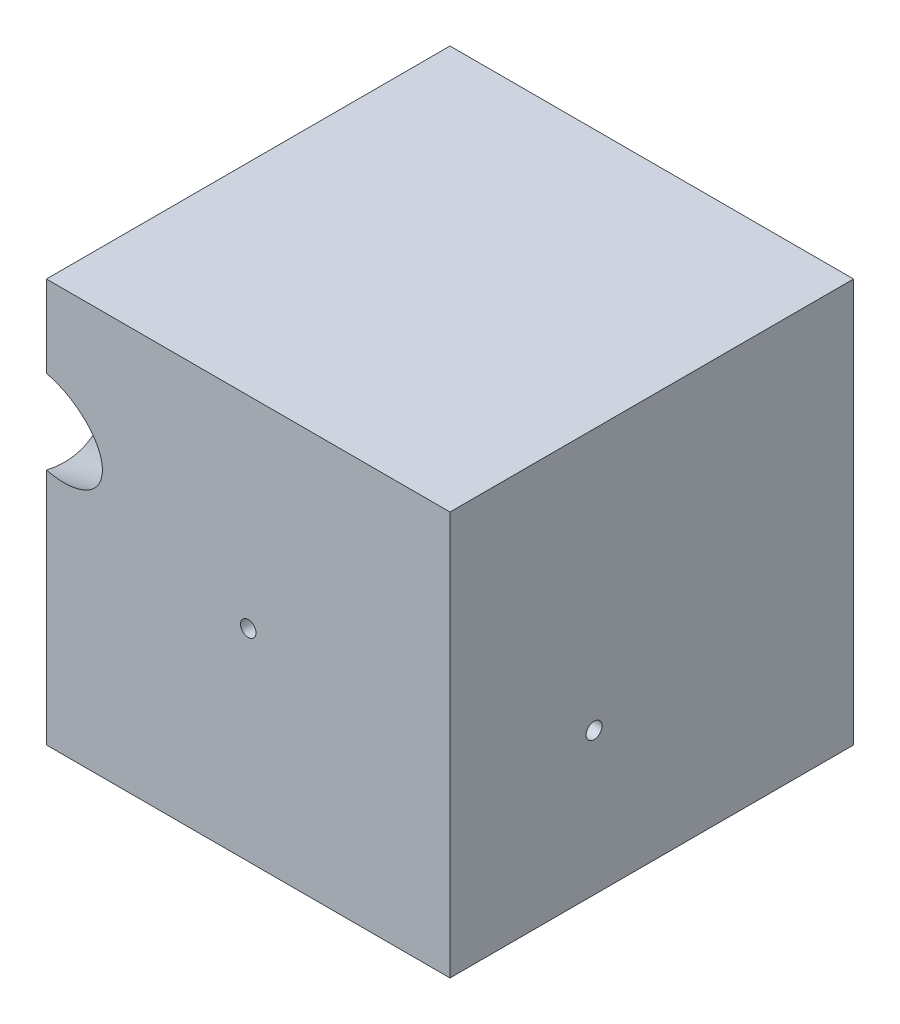
from build123d import *

# Parameters (mm, degrees)
SQUARE_W             = 52
SQUARE_H             = 52
CUBE_EXTRUSION_DEPTH = 52
STICK_CUT_START      = 15
STICK_HOLE_R         = 5.1
STICK_CUT_DEPTH      = 90.048032459
SKETCH12_R           = 1
CUT_EXTRUDE8_DEPTH   = 12
CUT_EXTRUDE9_START   = -12
SKETCH13_R           = 1
CUT_EXTRUDE9_DEPTH   = 12
SKETCH14_R           = 1
CUT_EXTRUDE10_DEPTH  = 12
SKETCH15_R           = 1.030667793
CUT_EXTRUDE11_DEPTH  = 12
SKETCH16_R           = 1
CUT_EXTRUDE12_DEPTH  = 12


with BuildPart() as part:
    # Square → Cube-Extrusion (new body)
    with BuildSketch(Plane.XY):
        Rectangle(SQUARE_W, SQUARE_H)
    extrude(amount=CUBE_EXTRUSION_DEPTH)

    # Stick-Hole → Stick-Cut (cut, through all)
    with BuildSketch(Plane(origin=(-28.888888889, 14.444444444, 28.888888889), x_dir=(-0.7453559924999299, -0.2981423969999719, -0.596284793999944), z_dir=(0.6666666666666667, -0.3333333333333332, -0.6666666666666667)).offset(STICK_CUT_START)):
        with Locations(Location((-14.635839315, -14.230249471, 0), (0, 0, 18.434948823))):
            Circle(STICK_HOLE_R)
    extrude(amount=-STICK_CUT_DEPTH, mode=Mode.SUBTRACT)

    # Sketch12 → Cut-Extrude8 (cut)
    with BuildSketch(Plane.XY.offset(52)):
        Circle(SKETCH12_R)
    extrude(amount=-CUT_EXTRUDE8_DEPTH, mode=Mode.SUBTRACT)

    # Sketch13 → Cut-Extrude9 (cut)
    with BuildSketch(Plane(origin=(0, 0, 0), x_dir=(-1, 0, 0), z_dir=(0, 0, -1)).offset(CUT_EXTRUDE9_START)):
        with Locations(Location((0, 0, 0), (0, 0, 180))):
            Circle(SKETCH13_R)
    extrude(amount=CUT_EXTRUDE9_DEPTH, mode=Mode.SUBTRACT)

    # Sketch14 → Cut-Extrude10 (cut)
    with BuildSketch(Plane.ZY.offset(26)):
        with Locations((10.514408983, 15.48249327)):
            Circle(SKETCH14_R)
        with Locations((20.449310987, -13.814590013)):
            Circle(SKETCH14_R)
    extrude(amount=-CUT_EXTRUDE10_DEPTH, mode=Mode.SUBTRACT)

    # Sketch15 → Cut-Extrude11 (cut)
    with BuildSketch(Plane(origin=(26, 0, 0), x_dir=(0, 0, -1), z_dir=(1, 0, 0))):
        with Locations((-33.439884797, -7.650599719)):
            Circle(SKETCH15_R)
    extrude(amount=-CUT_EXTRUDE11_DEPTH, mode=Mode.SUBTRACT)

    # Sketch16 → Cut-Extrude12 (cut)
    with BuildSketch(Plane.XZ.offset(26)):
        with Locations(Location((-9, 44.28, 0), (0, 0, 270))):
            Circle(SKETCH16_R)
    extrude(amount=-CUT_EXTRUDE12_DEPTH, mode=Mode.SUBTRACT)


solid = part.part
